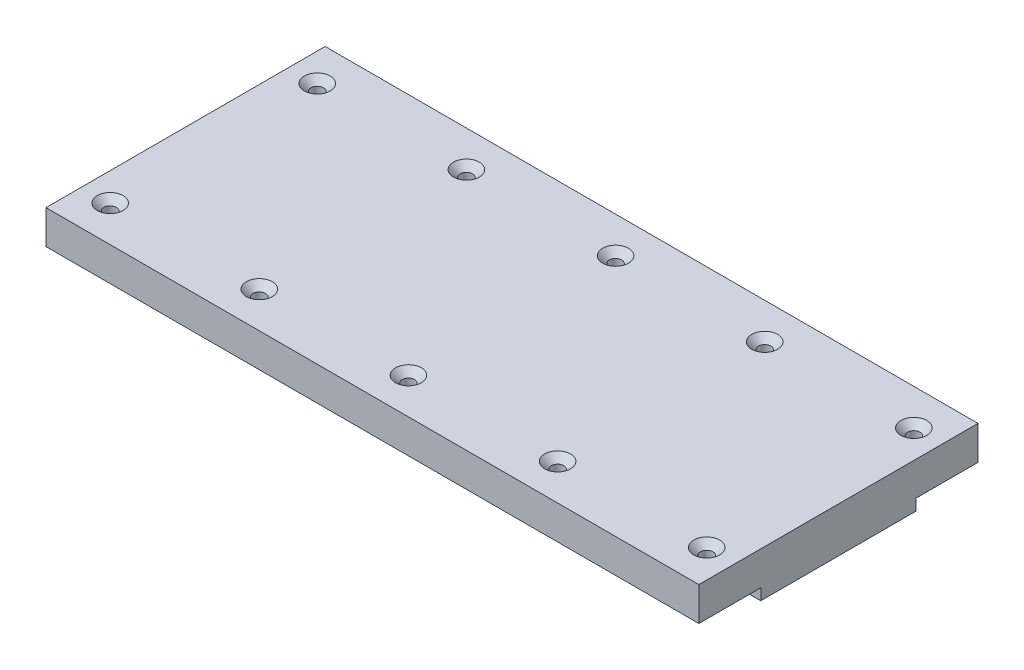
from build123d import *

# Parameters (mm, degrees)
CROQUIS1_W              = 580
CROQUIS1_H              = 138
SALIENTE_EXTRUIR1_DEPTH = 10
CROQUIS2_W              = 580
CROQUIS2_H              = 248
SALIENTE_EXTRUIR2_DEPTH = 30
CROQUIS3_R              = 5.5
CORTAR_EXTRUIR1_DEPTH   = 318.924519344
CHAFL_N1_SIZE           = 6


with BuildPart() as part:
    # Croquis1 → Saliente-Extruir1 (new body)
    with BuildSketch(Plane(origin=(0, 0, 0), x_dir=(1, 0, 0), z_dir=(0, 1, 0))):
        Rectangle(CROQUIS1_W, CROQUIS1_H)
    extrude(amount=SALIENTE_EXTRUIR1_DEPTH)

    # Croquis2 → Saliente-Extruir2 (add)
    with BuildSketch(Plane(origin=(0, 10, 0), x_dir=(1, 0, 0), z_dir=(0, 1, 0))):
        Rectangle(CROQUIS2_W, CROQUIS2_H)
    extrude(amount=SALIENTE_EXTRUIR2_DEPTH)

    # Croquis3 → Cortar-Extruir1 (cut, through all)
    with BuildSketch(Plane(origin=(0, 40, 0), x_dir=(1, 0, 0), z_dir=(0, 1, 0))):
        with Locations(Location((-265, 92, 0), (0, 0, 270))):
            Circle(CROQUIS3_R)
        with Locations(Location((-132.5, 92, 0), (0, 0, 270))):
            Circle(CROQUIS3_R)
        with Locations(Location((0, 92, 0), (0, 0, 270))):
            Circle(CROQUIS3_R)
        with Locations(Location((132.5, 92, 0), (0, 0, 270))):
            Circle(CROQUIS3_R)
        with Locations(Location((265, 92, 0), (0, 0, 270))):
            Circle(CROQUIS3_R)
        with Locations(Location((-265, -92, 0), (0, 0, 270))):
            Circle(CROQUIS3_R)
        with Locations(Location((-132.5, -92, 0), (0, 0, 270))):
            Circle(CROQUIS3_R)
        with Locations(Location((0, -92, 0), (0, 0, 270))):
            Circle(CROQUIS3_R)
        with Locations(Location((132.5, -92, 0), (0, 0, 270))):
            Circle(CROQUIS3_R)
        with Locations(Location((265, -92, 0), (0, 0, 270))):
            Circle(CROQUIS3_R)
    extrude(amount=-CORTAR_EXTRUIR1_DEPTH, mode=Mode.SUBTRACT)

    # Chaflán1
    chafl_n1_edges = [part.edges().sort_by_distance(p)[0] for p in [
        (-132.5, 40, -97.5),
        (0, 40, -97.5),
        (132.5, 40, -97.5),
        (265, 40, -97.5),
        (-265, 40, 86.5),
        (-132.5, 40, 86.5),
        (0, 40, 86.5),
        (132.5, 40, 86.5),
        (265, 40, 86.5),
        (-265, 40, -97.5),
    ]]
    chamfer(chafl_n1_edges, length=CHAFL_N1_SIZE)


solid = part.part
